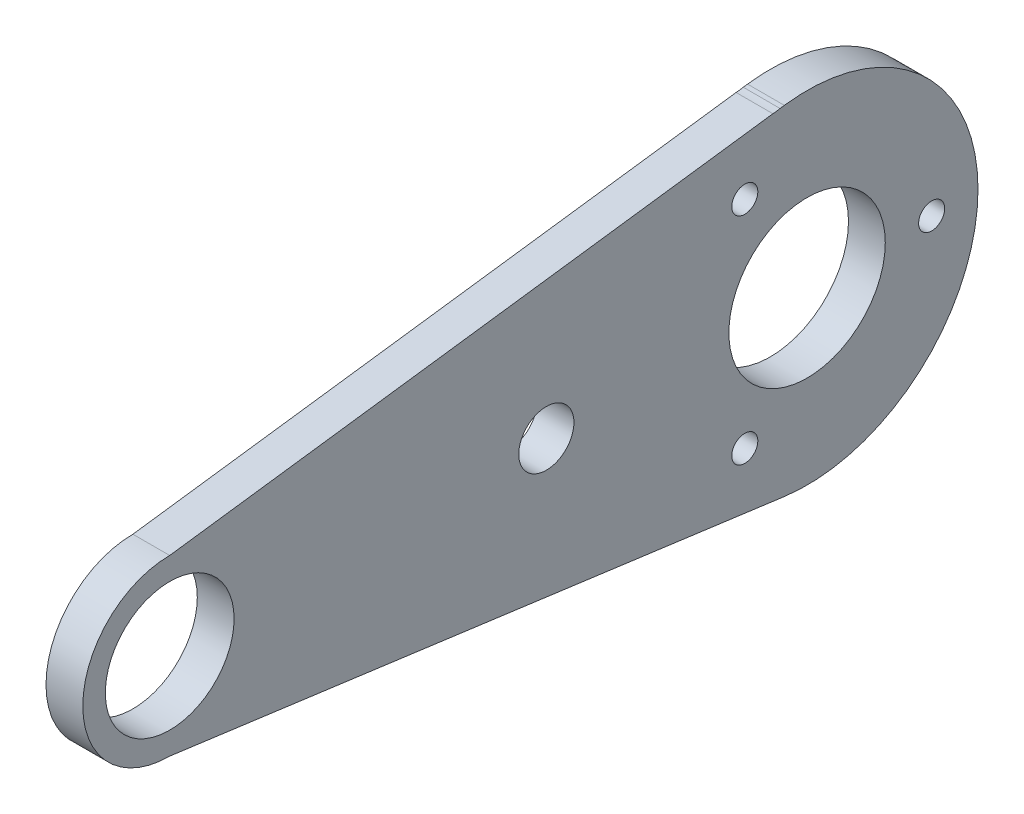
from build123d import *

# Parameters (mm, degrees)
SKETCH1_R                  = 11.1125
SKETCH1_R_2                = 13.5
BOSS_EXTRUDE1_DEPTH        = 3.175
M4_CLEARANCE_HOLE1_D       = 4.5
F_3_8_0_3750_DOWEL_HOLE1_D = 9.525


with BuildPart() as part:
    # Sketch1 → Boss-Extrude1 (new, symmetric)
    with BuildSketch(Plane(origin=(0, 0, 0), x_dir=(0, 0, -1), z_dir=(1, 0, 0))):
        with BuildLine():
            Line((104.098699929, 28.972456546), (0, 15))
            ThreePointArc((0, 15), (-2.052648501, 14.858890744), (-4.066677309, 14.438217884))
            ThreePointArc((-4.066677309, 14.438217884), (-14.858890744, -2.052648501), (0, -15))
            Line((0, -15), (106.075609583, -29.237803609))
            ThreePointArc((106.075609583, -29.237803609), (136.491140548, -12.979579055), (130.699290202, 21.018786481))
            ThreePointArc((130.699290202, 21.018786481), (119.340095093, 27.982362725), (106.075609583, 29.237803609))
            Line((106.075609583, 29.237803609), (105.337220563, 29.1386947))
            ThreePointArc((105.337220563, 29.1386947), (104.721310863, 29.030612592), (104.098699929, 28.972456546))
        make_face()
        Circle(SKETCH1_R, mode=Mode.SUBTRACT)
        with Locations((110, 0)):
            Circle(SKETCH1_R_2, mode=Mode.SUBTRACT)
    extrude(amount=BOSS_EXTRUDE1_DEPTH, both=True)

    # M4 Clearance Hole1 (through all)
    with Locations(Plane(origin=(3.175, 0, 0), x_dir=(0, 0, -1), z_dir=(1, 0, 0))):
        with Locations((99.25, 18.619546181), (131.5, 0), (99.25, -18.619546181)):
            Hole(M4_CLEARANCE_HOLE1_D / 2)

    # 3/8 (0.3750) Dowel Hole1 (through all)
    with Locations(Plane(origin=(3.175, 0, 0), x_dir=(0, 0, -1), z_dir=(1, 0, 0))):
        with Locations((65, 0)):
            Hole(F_3_8_0_3750_DOWEL_HOLE1_D / 2)


solid = part.part
